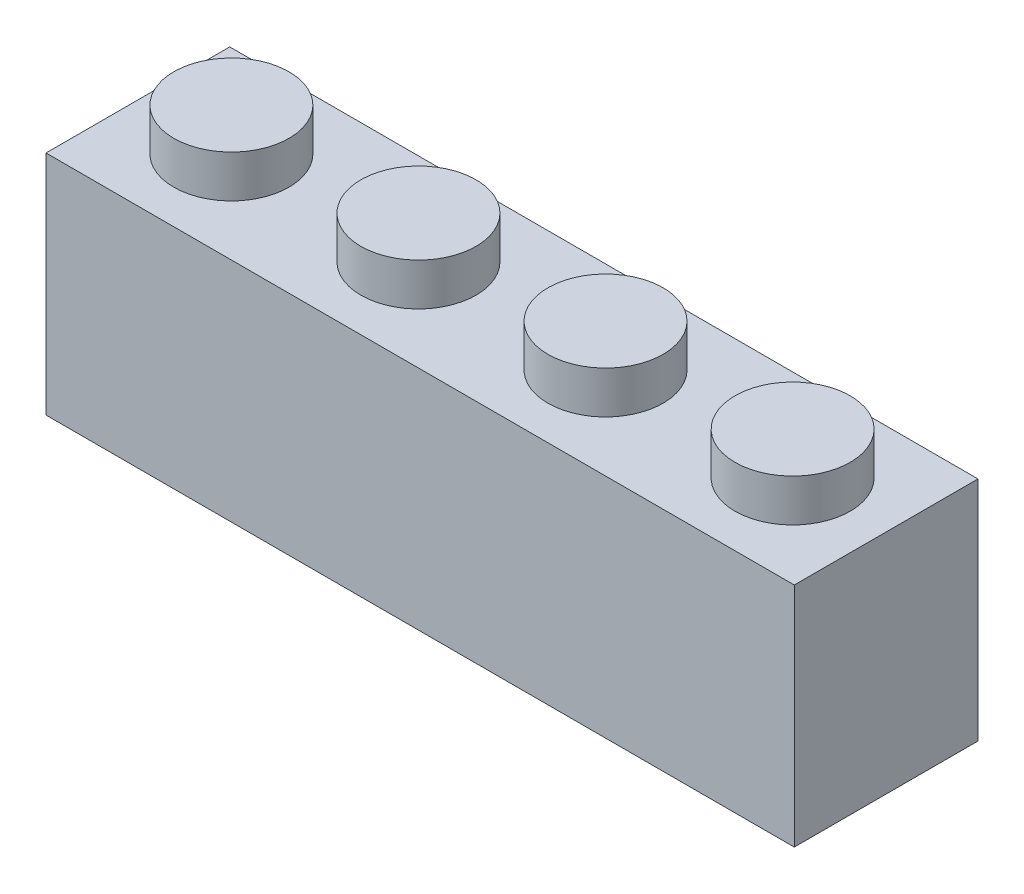
from build123d import *

# Parameters (mm, degrees)
SKETCH2_W           = 31.81
SKETCH2_H           = 7.81
BOSS_EXTRUDE1_DEPTH = 9.65
SKETCH3_R           = 2.45
BOSS_EXTRUDE2_DEPTH = 1.8
SHELL1_T            = -1.5
SKETCH4_R           = 1.5
BOSS_EXTRUDE3_DEPTH = 7.95


with BuildPart() as part:
    # Sketch2 → Boss-Extrude1 (new body)
    with BuildSketch(Plane(origin=(0, 0, 0), x_dir=(1, 0, 0), z_dir=(0, 1, 0))):
        Rectangle(SKETCH2_W, SKETCH2_H)
    extrude(amount=-BOSS_EXTRUDE1_DEPTH)

    # Sketch3 → Boss-Extrude2 (add)
    with BuildSketch(Plane(origin=(0, 0, 0), x_dir=(1, 0, 0), z_dir=(0, 1, 0))):
        with Locations(Location((-11.92875, 0, 0), (0, 0, 270))):
            Circle(SKETCH3_R)
        with Locations(Location((-3.97625, 0, 0), (0, 0, 270))):
            Circle(SKETCH3_R)
        with Locations(Location((3.97625, 0, 0), (0, 0, 270))):
            Circle(SKETCH3_R)
        with Locations(Location((11.92875, 0, 0), (0, 0, 270))):
            Circle(SKETCH3_R)
    extrude(amount=BOSS_EXTRUDE2_DEPTH)

    # Shell1
    shell1_openings = [part.faces().sort_by_distance(p)[0] for p in [
        (0, -9.65, 0),
    ]]
    offset(amount=SHELL1_T, openings=shell1_openings, kind=Kind.INTERSECTION)

    # Sketch4 → Boss-Extrude3 (add)
    with BuildSketch(Plane.XZ.offset(1.5)):
        with Locations(Location((-7.9525, 0, 0), (0, 0, 90))):
            Circle(SKETCH4_R)
        with Locations(Location((0, 0, 0), (0, 0, 90))):
            Circle(SKETCH4_R)
        with Locations(Location((7.9525, 0, 0), (0, 0, 90))):
            Circle(SKETCH4_R)
    extrude(amount=BOSS_EXTRUDE3_DEPTH)


solid = part.part
